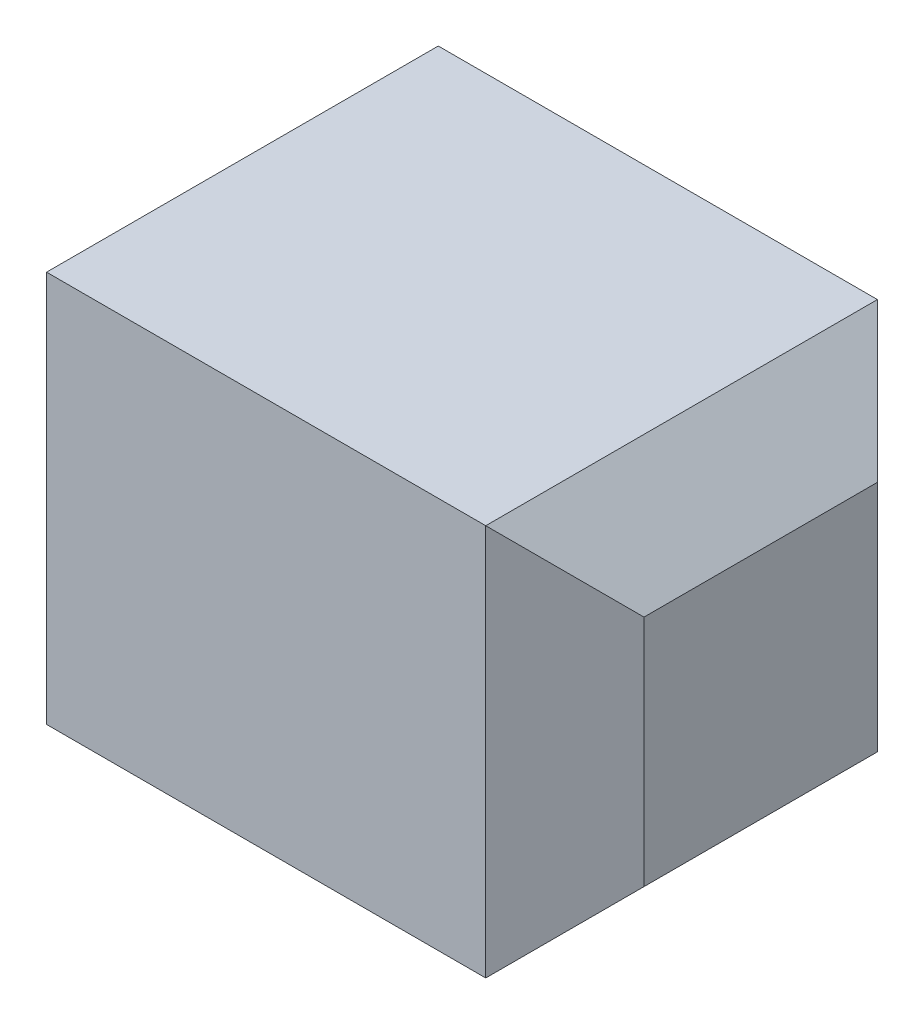
from build123d import *

# Parameters (mm, degrees)
SKETCH1_W           = 6.2865
SKETCH1_H           = 6.2865
BOSS_EXTRUDE1_DEPTH = 11.43
CHAMFER1_SIZE       = 1.27
CHAMFER2_SIZE       = 3.1115


with BuildPart() as part:
    # Sketch1 → Boss-Extrude1 (new body)
    with BuildSketch(Plane(origin=(0, 0, 0), x_dir=(0, 0, -1), z_dir=(1, 0, 0))):
        with Locations((3.14325, 3.14325)):
            Rectangle(SKETCH1_W, SKETCH1_H)
    extrude(amount=BOSS_EXTRUDE1_DEPTH)

    # Chamfer1
    chamfer1_edges = [part.edges().sort_by_distance(p)[0] for p in [
        (11.43, 3.14325, -6.2865),
        (11.43, 0, -3.14325),
        (11.43, 3.14325, 0),
        (11.43, 6.2865, -3.14325),
    ]]
    chamfer(chamfer1_edges, length=CHAMFER1_SIZE)

    # Chamfer2
    chamfer2_edges = [part.edges().sort_by_distance(p)[0] for p in [
        (0, 0, -3.14325),
        (0, 3.14325, -6.2865),
        (0, 6.2865, -3.14325),
        (0, 3.14325, 0),
    ]]
    chamfer(chamfer2_edges, length=CHAMFER2_SIZE)


solid = part.part
